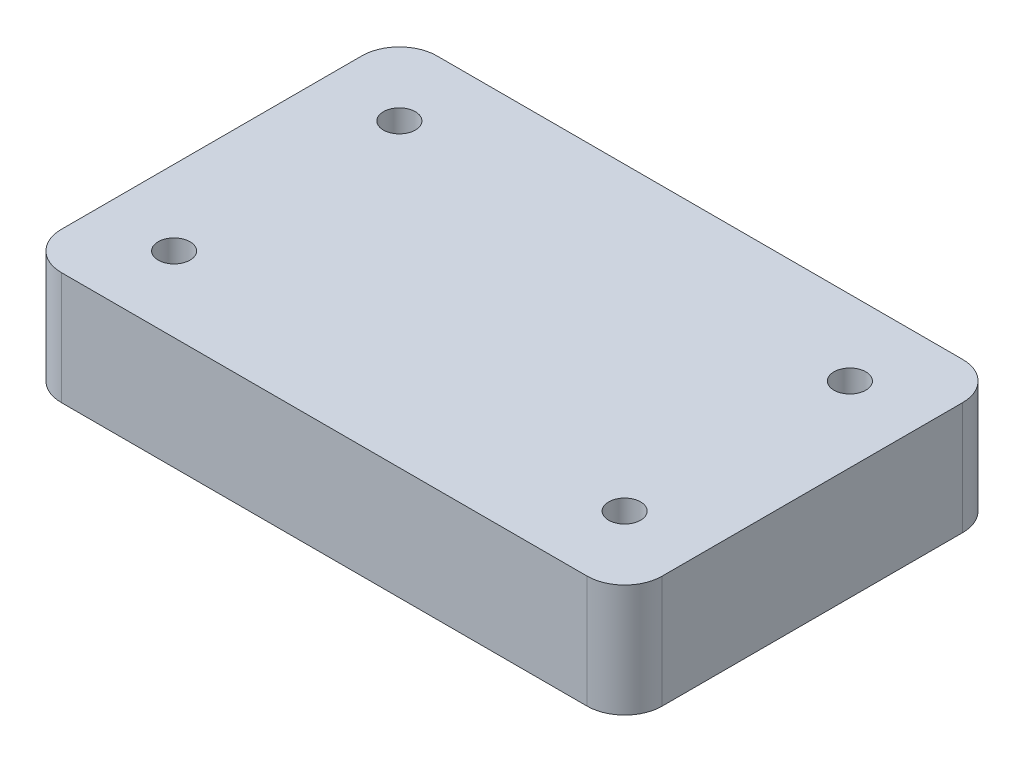
from build123d import *

# Parameters (mm, degrees)
SALIENTE_EXTRUIR1_DEPTH    = 30
TALADRO_ROSCADO_M10X1_51_D = 8.5


with BuildPart() as part:
    # Croquis1 → Saliente-Extruir1 (new body)
    with BuildSketch(Plane(origin=(0, 0, 0), x_dir=(1, 0, 0), z_dir=(0, 1, 0))):
        with BuildLine():
            Line((-70, -50), (70, -50))
            ThreePointArc((70, -50), (77.071067812, -47.071067812), (80, -40))
            Line((80, -40), (80, 40))
            ThreePointArc((80, 40), (77.071067812, 47.071067812), (70, 50))
            Line((70, 50), (-70, 50))
            ThreePointArc((-70, 50), (-77.071067812, 47.071067812), (-80, 40))
            Line((-80, 40), (-80, -40))
            ThreePointArc((-80, -40), (-77.071067812, -47.071067812), (-70, -50))
        make_face()
    extrude(amount=SALIENTE_EXTRUIR1_DEPTH)

    # Taladro roscado M10x1.51 (through all)
    with Locations(Plane(origin=(0, 30, 0), x_dir=(1, 0, 0), z_dir=(0, 1, 0))):
        with Locations((-60, 30), (60, 30), (60, -30), (-60, -30)):
            Hole(TALADRO_ROSCADO_M10X1_51_D / 2)


solid = part.part
